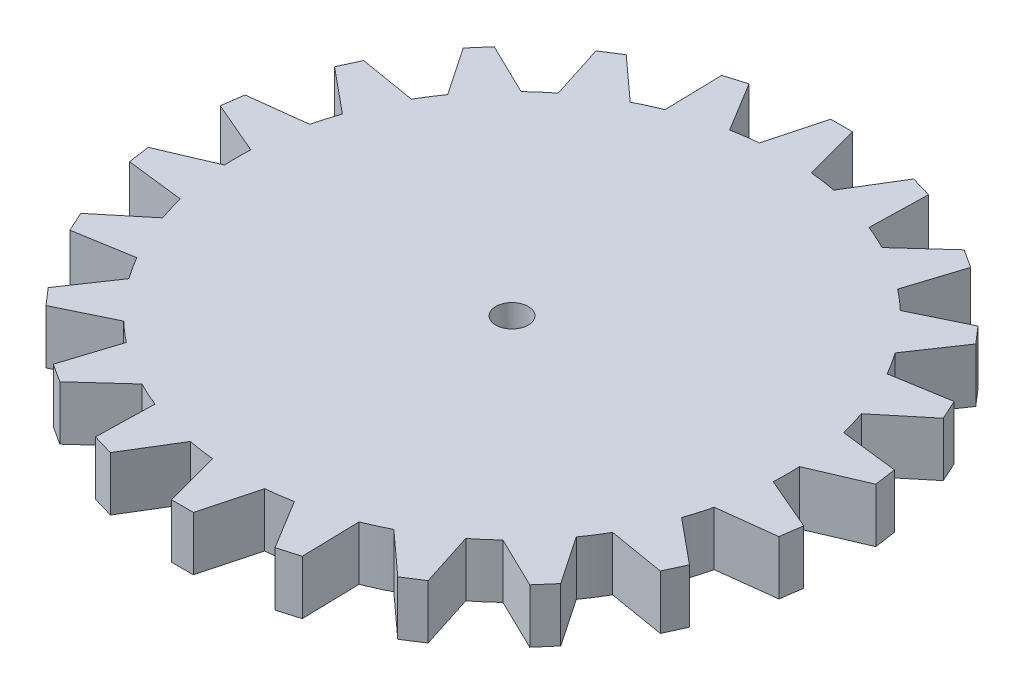
from build123d import *

# Parameters (mm, degrees)
SKETCH1_R           = 12.7
BOSS_EXTRUDE1_DEPTH = 2.5
BOSS_EXTRUDE2_DEPTH = 2.5
CIRPATTERN1_COUNT   = 22
SKETCH3_R           = 0.75
CUT_EXTRUDE1_DEPTH  = 5


with BuildPart() as part:
    # Sketch1 → Boss-Extrude1 (new body)
    with BuildSketch(Plane(origin=(0, 0, 0), x_dir=(1, 0, 0), z_dir=(0, 1, 0))):
        with Locations(Location((0, 0, 0), (0, 0, 270))):
            Circle(SKETCH1_R)
    extrude(amount=BOSS_EXTRUDE1_DEPTH)

    # Sketch2 → Boss-Extrude2 (add)
    with BuildSketch(Plane(origin=(0, 2.5, 0), x_dir=(1, 0, 0), z_dir=(0, 1, 0))):
        Polygon((-1.324709139, 12.192), (1.324709139, 12.192), (0.508, 15.24), (-0.508, 15.24), align=None)
    boss_extrude2 = extrude(amount=-BOSS_EXTRUDE2_DEPTH)

    # CirPattern1: Boss-Extrude2 ×22 about axis
    cirpattern1_axis = Axis((0, 0, 0), (0, 1, 0))
    for i in range(1, CIRPATTERN1_COUNT):
        add(boss_extrude2.rotate(cirpattern1_axis, i * 360 / CIRPATTERN1_COUNT))

    # Sketch3 → Cut-Extrude1 (cut)
    with BuildSketch(Plane(origin=(0, 2.5, 0), x_dir=(1, 0, 0), z_dir=(0, 1, 0))):
        with Locations(Location((0, 0, 0), (0, 0, 270))):
            Circle(SKETCH3_R)
    extrude(amount=-CUT_EXTRUDE1_DEPTH, mode=Mode.SUBTRACT)


solid = part.part
